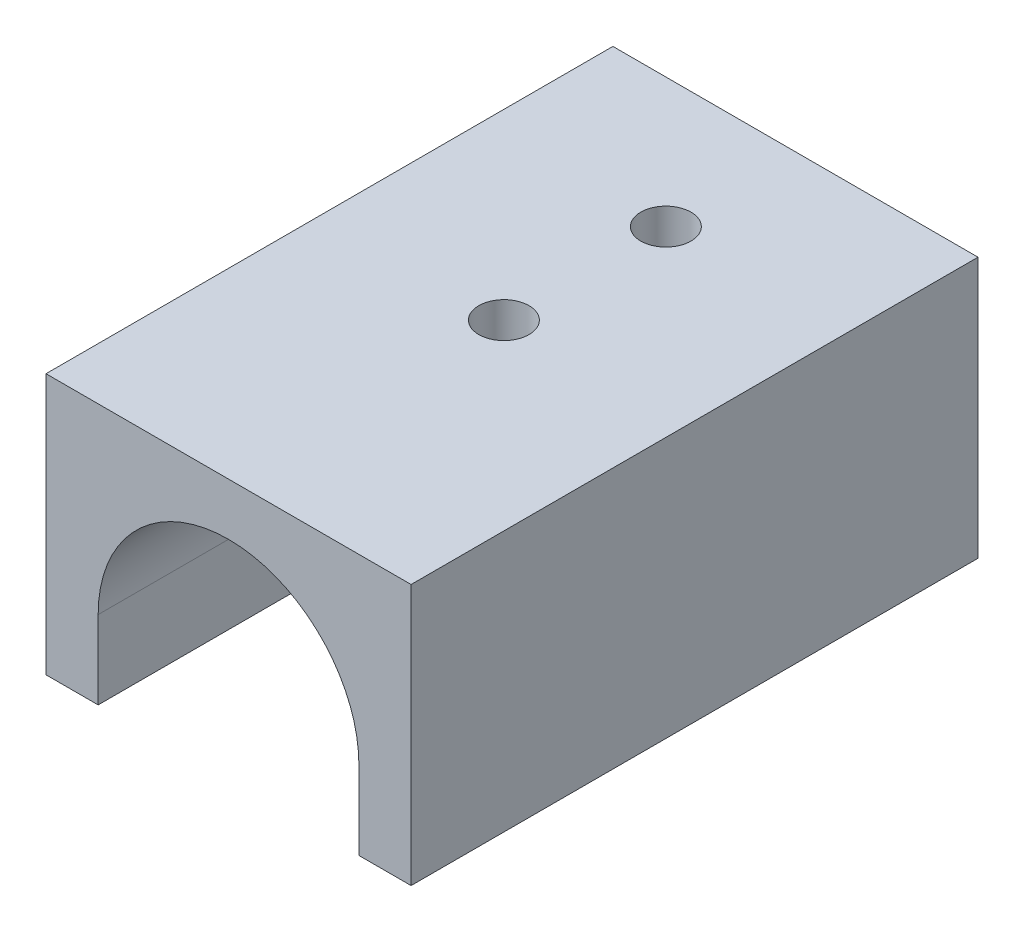
from build123d import *

# Parameters (mm, degrees)
BOSS_EXTRUDE1_DEPTH     = 17.5
CUT_EXTRUDE1_REACH      = 28.315
CUT_EXTRUDE1_END_RADIUS = 8.05
SKETCH2_R               = 1.55


with BuildPart() as part:
    # Sketch1 → Boss-Extrude1 (new, symmetric)
    with BuildSketch(Plane.XY):
        with BuildLine():
            Line((-11.27, 11.27), (11.27, 11.27))
            Line((11.27, 11.27), (11.27, -4.83))
            Line((11.27, -4.83), (8.05, -4.83))
            Line((8.05, -4.83), (8.05, 0))
            ThreePointArc((8.05, 0), (0, 8.05), (-8.05, 0))
            Line((-8.05, 0), (-8.05, -4.83))
            Line((-8.05, -4.83), (-11.27, -4.83))
            Line((-11.27, -4.83), (-11.27, 11.27))
        make_face()
    extrude(amount=BOSS_EXTRUDE1_DEPTH, both=True)

    # Cut-Extrude1: up to this cylinder (the profile starts outside it)
    cut_extrude1_end = Plane(origin=(0, 0, -4.5), z_dir=(0, 0, -1)) * Cylinder(CUT_EXTRUDE1_END_RADIUS, 83.73, mode=Mode.PRIVATE)
    # Sketch2 → Cut-Extrude1 (cut, up to the surface)
    with BuildSketch(Plane(origin=(0, 11.27, 0), x_dir=(1, 0, 0), z_dir=(0, 1, 0)), mode=Mode.PRIVATE) as cut_extrude1_sk1:
        with Locations(Location((0, 9.5, 0), (0, 0, 270))):
            Circle(SKETCH2_R)
    cut_extrude1_tool1 = extrude(cut_extrude1_sk1.sketch, amount=-CUT_EXTRUDE1_REACH, mode=Mode.PRIVATE) - cut_extrude1_end
    add(cut_extrude1_tool1.solids().sort_by_distance((0, 11.27, -9.5))[0], mode=Mode.SUBTRACT)
    # Sketch2 → Cut-Extrude1 (cut, up to the surface)
    with BuildSketch(Plane(origin=(0, 11.27, 0), x_dir=(1, 0, 0), z_dir=(0, 1, 0)), mode=Mode.PRIVATE) as cut_extrude1_sk2:
        with Locations(Location((0, -0.5, 0), (0, 0, 270))):
            Circle(SKETCH2_R)
    cut_extrude1_tool2 = extrude(cut_extrude1_sk2.sketch, amount=-CUT_EXTRUDE1_REACH, mode=Mode.PRIVATE) - cut_extrude1_end
    add(cut_extrude1_tool2.solids().sort_by_distance((0, 11.27, 0.5))[0], mode=Mode.SUBTRACT)


solid = part.part
